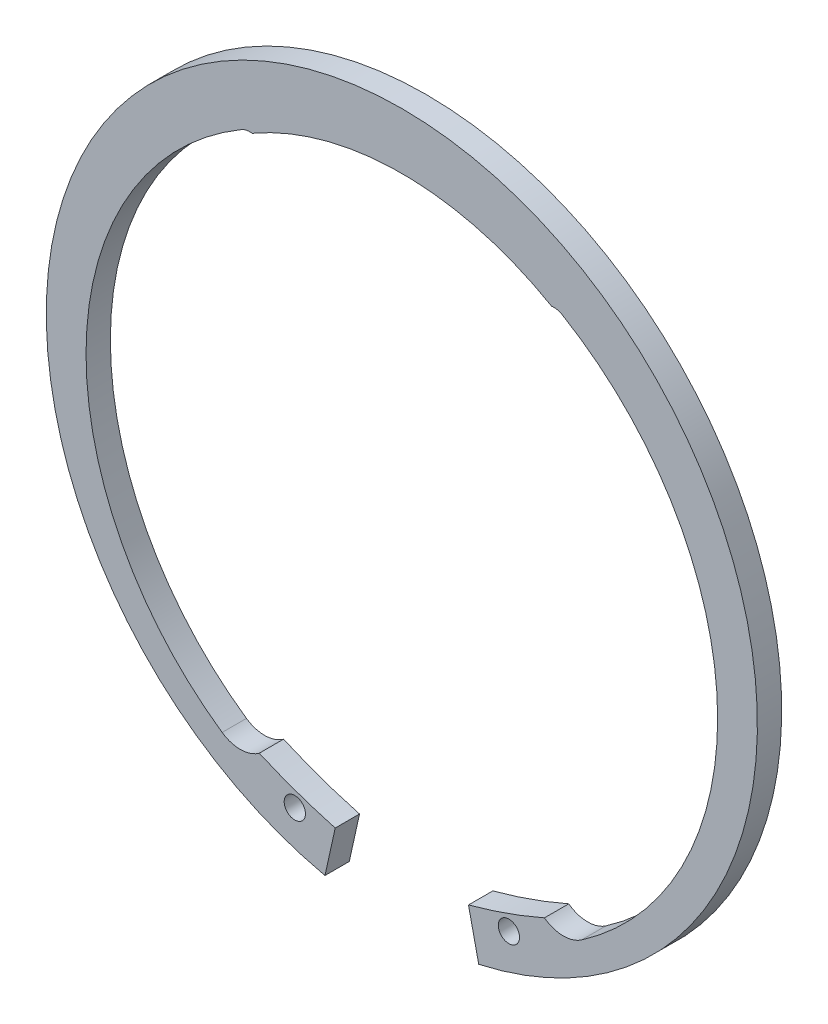
from build123d import *

# Parameters (mm, degrees)
BOSS_EXTRUDE1_DEPTH      = 2
BOSS_EXTRUDE1_DEPTH_BACK = 2
SKETCH3_R                = 1.75
BOSS_EXTRUDE2_START      = -2
BOSS_EXTRUDE2_DEPTH      = 4
CUT_EXTRUDE2_DEPTH       = 83.755664459


with BuildPart() as part:
    # Sketch3 → Boss-Extrude1 (new, two sides: drawn at the far end of the back side and taken through both)
    with BuildSketch(Plane.XY.offset(-BOSS_EXTRUDE1_DEPTH_BACK)):
        with BuildLine():
            Line((-12.648648649, -57.116212124), (-10.962162162, -49.500717174))
            Line((-10.962162162, -49.500717174), (-23.462338081, -45.092415448))
            ThreePointArc((-23.462338081, -45.092415448), (-26.50014347, -46.117965154), (-29.56784511, -45.185645238))
            ThreePointArc((-29.56784511, -45.185645238), (0, 49.5), (29.56784511, -45.185645238))
            ThreePointArc((29.56784511, -45.185645238), (26.50014347, -46.117965154), (23.462338081, -45.092415448))
            Line((23.462338081, -45.092415448), (10.962162162, -49.500717174))
            Line((10.962162162, -49.500717174), (12.648648649, -57.116212124))
            ThreePointArc((12.648648649, -57.116212124), (0, 58.5), (-12.648648649, -57.116212124))
        make_face()
        with Locations((-17.611521005, -49.939211163)):
            Circle(SKETCH3_R, mode=Mode.SUBTRACT)
        with Locations(Location((17.611521005, -49.939211163, 0), (0, 0, 180))):
            Circle(SKETCH3_R, mode=Mode.SUBTRACT)
    extrude(amount=BOSS_EXTRUDE1_DEPTH + BOSS_EXTRUDE1_DEPTH_BACK)

    # Sketch6 → Boss-Extrude2 (add)
    with BuildSketch(Plane.XY.offset(BOSS_EXTRUDE2_START)):
        with BuildLine():
            ThreePointArc((-24.625, 42.651751136), (0, 49.25), (24.625, 42.651751136))
            ThreePointArc((24.625, 42.651751136), (25.553522607, 42.616086127), (26.420381097, 42.28144814))
            ThreePointArc((26.420381097, 42.28144814), (0, 49.5), (-26.420381097, 42.28144814))
            ThreePointArc((-26.420381097, 42.28144814), (-25.553522607, 42.616086127), (-24.625, 42.651751136))
        make_face()
    extrude(amount=BOSS_EXTRUDE2_DEPTH)

    # Sketch5 → Cut-Extrude2 (cut, symmetric)
    with BuildSketch(Plane.XY):
        with BuildLine():
            Line((-23.462338081, -45.092415448), (0, 0))
            Line((0, 0), (-10.962162162, -49.500717174))
            ThreePointArc((-10.962162162, -49.500717174), (-17.295396026, -47.532334754), (-23.462338081, -45.092415448))
        make_face()
    cut_extrude2 = extrude(amount=CUT_EXTRUDE2_DEPTH, both=True, mode=Mode.SUBTRACT)

    # Mirror1: Cut-Extrude2 across plane
    add(cut_extrude2.mirror(Plane(origin=(0, 0, 0), x_dir=(0, 0, 1), z_dir=(1, 0, 0))), mode=Mode.SUBTRACT)


solid = part.part
